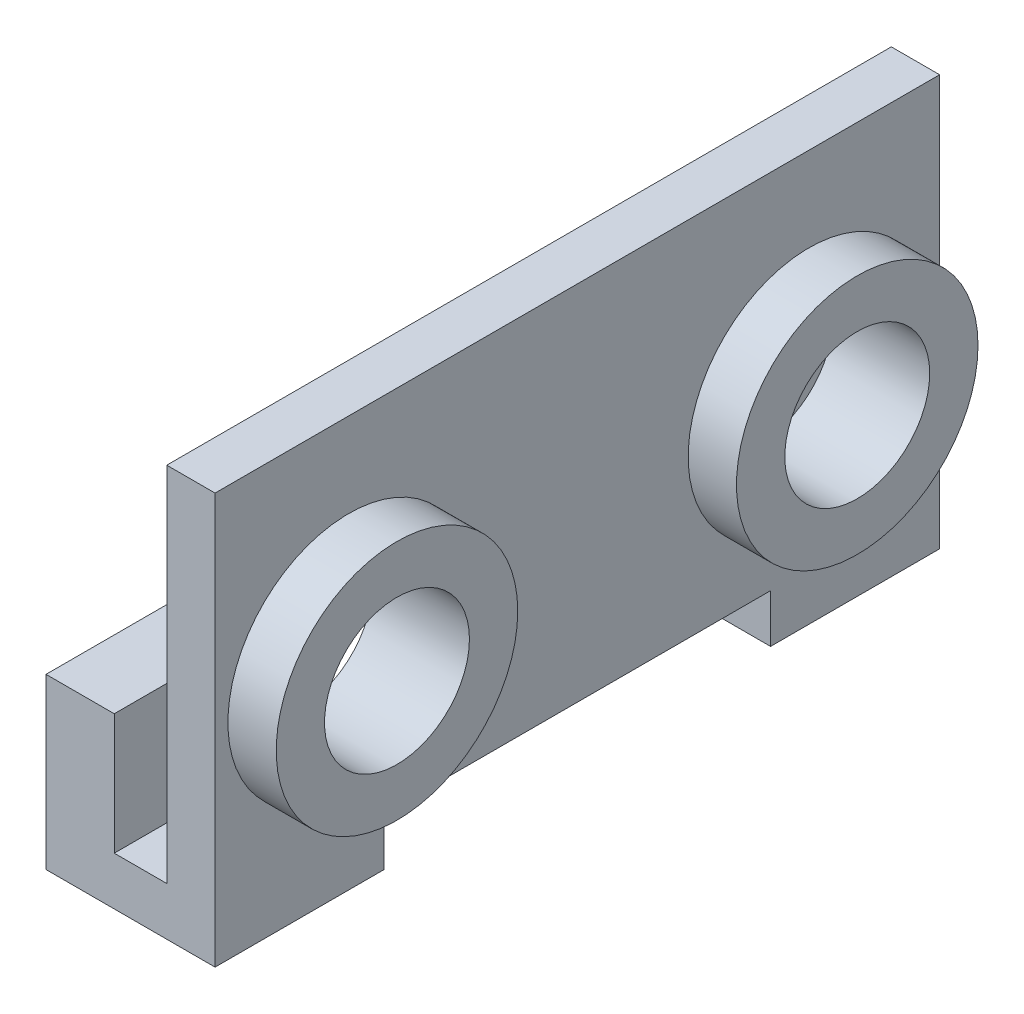
from build123d import *

# Parameters (mm, degrees)
ESQUISSE1_W             = 30
ESQUISSE1_H             = 17
BOSS_EXTRU_1_DEPTH      = 2
ESQUISSE2_R             = 5
BOSS_EXTRU_2_DEPTH      = 2
ESQUISSE3_R             = 3
ENL_V_MAT_EXTRU_1_DEPTH = 18.69887002
ESQUISSE4_R             = 3
ENL_V_MAT_EXTRU_2_DEPTH = 18.69887002
ESQUISSE7_W             = 2
ESQUISSE7_H             = 8
ENL_V_MAT_EXTRU_3_DEPTH = 2
ESQUISSE8_W             = 7
ESQUISSE8_H             = 2
BOSS_EXTRU_3_DEPTH      = 5
ESQUISSE12_W            = 2.825864409
ESQUISSE12_H            = 7
BOSS_EXTRU_4_DEPTH      = 5


with BuildPart() as part:
    # Esquisse1 → Boss.-Extru.1 (new body)
    with BuildSketch(Plane(origin=(0, 0, 0), x_dir=(0, 0, -1), z_dir=(1, 0, 0))):
        Rectangle(ESQUISSE1_W, ESQUISSE1_H)
    extrude(amount=BOSS_EXTRU_1_DEPTH)

    # Esquisse2 → Boss.-Extru.2 (add)
    with BuildSketch(Plane(origin=(2, 0, 0), x_dir=(0, 0, -1), z_dir=(1, 0, 0))):
        with Locations((-9.467846224, 0)):
            Circle(ESQUISSE2_R)
        with Locations((9.588622493, 0)):
            Circle(ESQUISSE2_R)
    extrude(amount=BOSS_EXTRU_2_DEPTH)

    # Esquisse3 → Enlèv. mat.-Extru.1 (cut, through all)
    with BuildSketch(Plane(origin=(4, 0, 0), x_dir=(0, 0, -1), z_dir=(1, 0, 0))):
        with Locations((-9.467846224, 0)):
            Circle(ESQUISSE3_R)
    extrude(amount=-ENL_V_MAT_EXTRU_1_DEPTH, mode=Mode.SUBTRACT)

    # Esquisse4 → Enlèv. mat.-Extru.2 (cut, through all)
    with BuildSketch(Plane(origin=(4, 0, 0), x_dir=(0, 0, -1), z_dir=(1, 0, 0))):
        with Locations((9.588622493, 0)):
            Circle(ESQUISSE4_R)
    extrude(amount=-ENL_V_MAT_EXTRU_2_DEPTH, mode=Mode.SUBTRACT)

    # Esquisse7 → Enlèv. mat.-Extru.3 (cut)
    with BuildSketch(Plane.XZ.offset(8.5)):
        with Locations((1, 4)):
            Rectangle(ESQUISSE7_W, ESQUISSE7_H)
    enl_v_mat_extru_3 = extrude(amount=-ENL_V_MAT_EXTRU_3_DEPTH, mode=Mode.SUBTRACT)

    # Symétrie1: Enlèv. mat.-Extru.3 across plane
    add(enl_v_mat_extru_3.mirror(Plane.XY), mode=Mode.SUBTRACT)

    # Esquisse8 → Boss.-Extru.3 (add)
    with BuildSketch(Plane.ZY):
        with Locations((-11.5, -7.5)):
            Rectangle(ESQUISSE8_W, ESQUISSE8_H)
    boss_extru_3 = extrude(amount=BOSS_EXTRU_3_DEPTH)

    # Esquisse12 → Boss.-Extru.4 (add)
    with BuildSketch(Plane(origin=(0, -6.5, 0), x_dir=(1, 0, 0), z_dir=(0, 1, 0))):
        with Locations((-3.587067796, 11.5)):
            Rectangle(ESQUISSE12_W, ESQUISSE12_H)
    boss_extru_4 = extrude(amount=BOSS_EXTRU_4_DEPTH)

    # Symétrie2: Boss.-Extru.3, Boss.-Extru.4 across plane
    add(boss_extru_3.mirror(Plane.XY))
    add(boss_extru_4.mirror(Plane.XY))


solid = part.part
